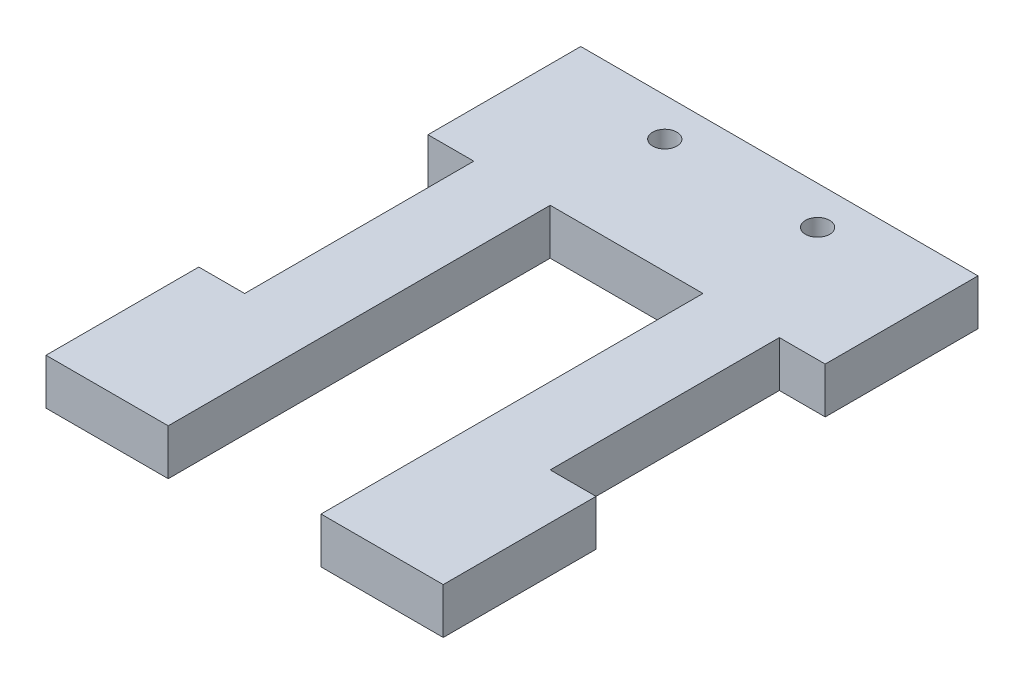
from build123d import *

# Parameters (mm, degrees)
BOSS_EXTRUDE1_DEPTH = 6
SKETCH2_R           = 1.5875
CUT_EXTRUDE1_DEPTH  = 45.011362169


with BuildPart() as part:
    # Sketch1 → Boss-Extrude1 (new body)
    with BuildSketch(Plane(origin=(0, 0, 0), x_dir=(1, 0, 0), z_dir=(0, 1, 0))):
        Polygon((-10, -35), (-10, 15), (10, 15), (10, -35), (26, -35), (26, -15), (20, -15), (20, 15), (26, 15), (26, 35), (-26, 35), (-26, 15), (-20, 15), (-20, -15), (-26, -15), (-26, -35), align=None)
    extrude(amount=BOSS_EXTRUDE1_DEPTH)

    # Sketch2 → Cut-Extrude1 (cut, through all)
    with BuildSketch(Plane(origin=(0, 6, 0), x_dir=(1, 0, 0), z_dir=(0, 1, 0))):
        with Locations(Location((-10, 30, 0), (0, 0, 270))):
            Circle(SKETCH2_R)
        with Locations(Location((10, 30, 0), (0, 0, 90))):
            Circle(SKETCH2_R)
    extrude(amount=-CUT_EXTRUDE1_DEPTH, mode=Mode.SUBTRACT)


solid = part.part
